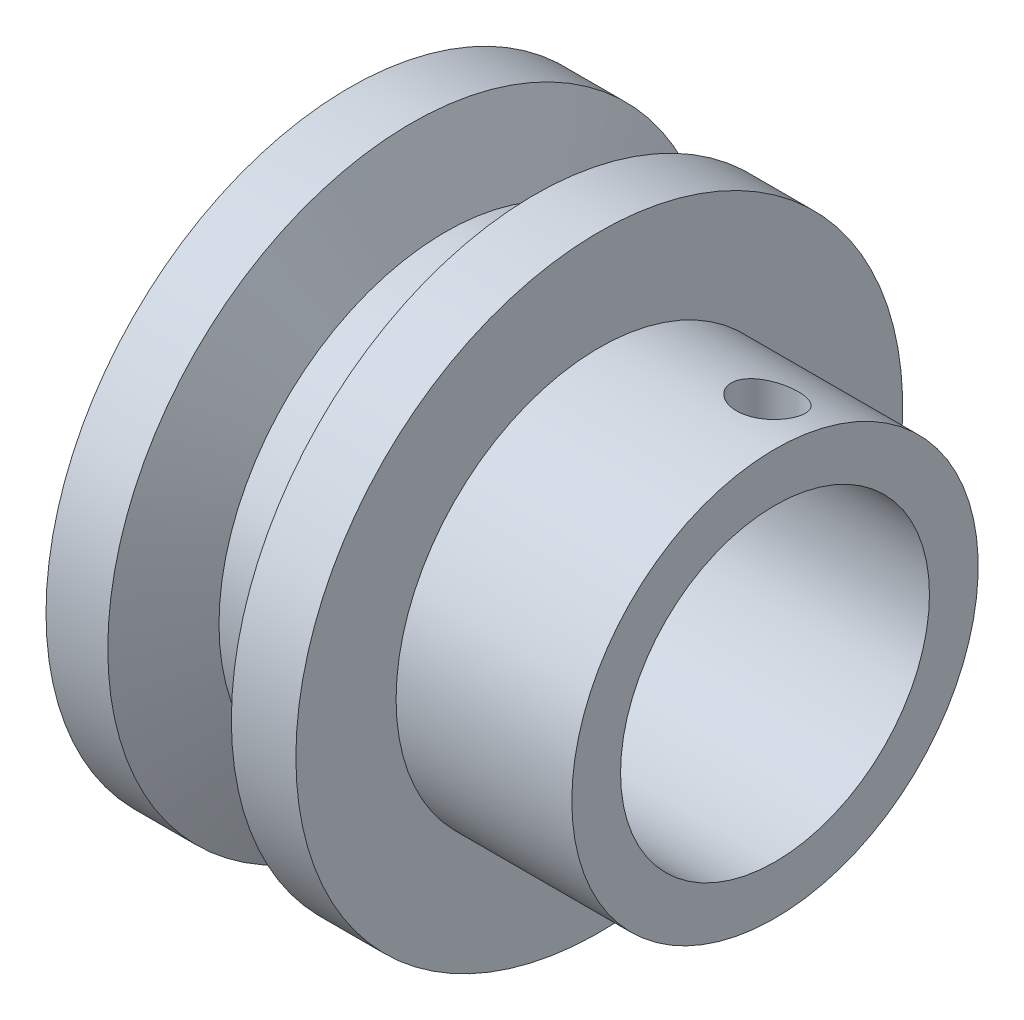
from build123d import *

# Parameters (mm, degrees)
SKETCH1_W          = 201.666666667
SKETCH1_H          = 73.666666667
SKETCH9_R          = 75
CUT_EXTRUDE1_DEPTH = 294.471179732
SKETCH14_R         = 15
CUT_EXTRUDE4_DEPTH = 268.773118171


with BuildPart() as part:
    # Sketch1 → Revolve4 (revolve)
    with BuildSketch(Plane.XY, mode=Mode.PRIVATE) as revolve4_sk:
        with Locations((-36.632641292, 36.833333334)):
            Rectangle(SKETCH1_W, SKETCH1_H)
        Polygon((-112.465974625, 147.333333333), (-142.465974625, 147.333333333), (-142.465974625, 0), (-137.465974625, 0), (-137.465974625, 73.666666667), (64.200692042, 73.666666667), (64.200692042, 98.666666667), (-21.132641292, 98.666666667), (-21.132641292, 147.333333333), (-52.465974625, 147.333333333), (-75.799307958, 110), (-95.799307958, 110), align=None)
    revolve(revolve4_sk.sketch.rotate(Axis((-184.465974625, 0, 0), (1, 0, 0)), 90), axis=Axis((-184.465974625, 0, 0), (1, 0, 0)))

    # Sketch9 → Cut-Extrude1 (cut, through all)
    with BuildSketch(Plane.ZY.offset(142.465974625)):
        Circle(SKETCH9_R)
    extrude(amount=-CUT_EXTRUDE1_DEPTH, mode=Mode.SUBTRACT)

    # Sketch14 → Cut-Extrude4 (cut, through all)
    with BuildSketch(Plane(origin=(0, 25, 0), x_dir=(1, 0, 0), z_dir=(0, 1, 0))):
        with Locations(Location((38.628593536, 21.914529815, 0), (0, 0, 90))):
            Circle(SKETCH14_R)
    extrude(amount=CUT_EXTRUDE4_DEPTH, mode=Mode.SUBTRACT)


solid = part.part
